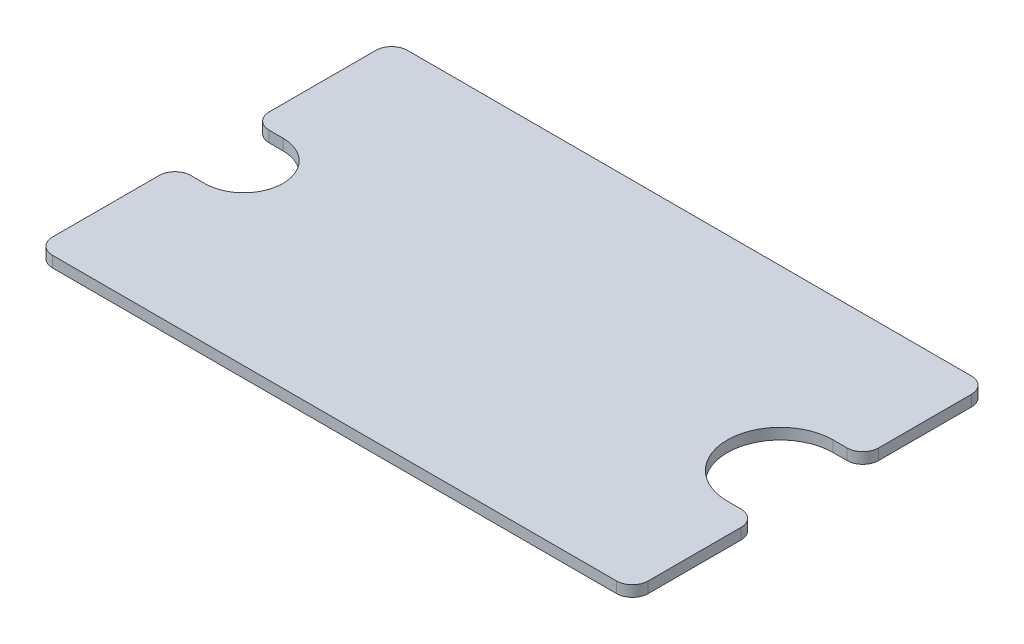
from build123d import *

# Parameters (mm, degrees)
SKETCH1_W           = 95
SKETCH1_H           = 60
BOSS_EXTRUDE1_DEPTH = 6
SKETCH6_R           = 3.5
SKETCH6_R_2         = 1.5
CUT_EXTRUDE3_DEPTH  = 113.521109131
CUT_EXTRUDE1_DEPTH  = 113.521109131
FILLET3_R           = 1.5
SKETCH7_W           = 8.5
SKETCH7_H           = 3
SKETCH7_H_2         = 7
CUT_EXTRUDE4_DEPTH  = 113.521109131
FILLET4_R           = 5
FILLET5_R           = 1.5
BOSS_EXTRUDE2_DEPTH = 1.6
SKETCH10_W          = 102.175429208
SKETCH10_H          = 24.243237214
CUT_EXTRUDE6_DEPTH  = 113.617760589


with BuildPart() as part:
    # Sketch1 → Boss-Extrude1 (new body)
    with BuildSketch(Plane(origin=(0, 0, 0), x_dir=(1, 0, 0), z_dir=(0, 1, 0))):
        with Locations((47.5, 30)):
            Rectangle(SKETCH1_W, SKETCH1_H)
    extrude(amount=BOSS_EXTRUDE1_DEPTH)

    # Sketch6 → Cut-Extrude3 (cut, through all)
    with BuildSketch(Plane.XZ):
        with Locations((86.5, -30)):
            Circle(SKETCH6_R)
        with Locations((8.5, -30)):
            Circle(SKETCH6_R_2)
    extrude(amount=-CUT_EXTRUDE3_DEPTH, mode=Mode.SUBTRACT)

    # Sketch2 → Cut-Extrude1 (cut, through all)
    with BuildSketch(Plane(origin=(0, 6, 0), x_dir=(-1, 0, 0), z_dir=(0, 1, 0))):
        with BuildLine():
            Line((-8.5, -36.5), (-5, -36.5))
            Line((-5, -36.5), (-5, -55))
            Line((-5, -55), (-90, -55))
            Line((-90, -55), (-90, -38.5))
            Line((-90, -38.5), (-86.5, -38.5))
            ThreePointArc((-86.5, -38.5), (-78, -30), (-86.5, -21.5))
            Line((-86.5, -21.5), (-90, -21.5))
            Line((-90, -21.5), (-90, -5))
            Line((-90, -5), (-5, -5))
            Line((-5, -5), (-5, -23.5))
            Line((-5, -23.5), (-8.5, -23.5))
            ThreePointArc((-8.5, -23.5), (-15, -30), (-8.5, -36.5))
        make_face()
    extrude(amount=-CUT_EXTRUDE1_DEPTH, mode=Mode.SUBTRACT)

    # Fillet3
    fillet3_edges = [part.edges().sort_by_distance(p)[0] for p in [
        (90, 3, -55),
    ]]
    fillet(fillet3_edges, radius=FILLET3_R)

    # Sketch7 → Cut-Extrude4 (cut, through all)
    with BuildSketch(Plane(origin=(0, 6, 0), x_dir=(-1, 0, 0), z_dir=(0, 1, 0))):
        with Locations((-4.25, -30)):
            Rectangle(SKETCH7_W, SKETCH7_H)
        with Locations((-90.75, -30)):
            Rectangle(SKETCH7_W, SKETCH7_H_2)
    extrude(amount=-CUT_EXTRUDE4_DEPTH, mode=Mode.SUBTRACT)

    # Fillet4
    fillet4_edges = [part.edges().sort_by_distance(p)[0] for p in [
        (95, 3, -33.5),
        (0, 3, 0),
        (0, 3, -28.5),
        (0, 3, -31.5),
        (0, 3, -60),
        (95, 3, -60),
        (95, 3, -26.5),
        (95, 3, 0),
    ]]
    fillet(fillet4_edges, radius=FILLET4_R)

    # Fillet5
    fillet5_edges = [part.edges().sort_by_distance(p)[0] for p in [
        (90, 3, -38.5),
        (90, 3, -5),
        (90, 3, -21.5),
        (5, 3, -5),
        (5, 3, -36.5),
        (5, 3, -23.5),
        (5, 3, -55),
    ]]
    fillet(fillet5_edges, radius=FILLET5_R)

    # Sketch9 → Boss-Extrude2 (add)
    with BuildSketch(Plane(origin=(0, 6, 0), x_dir=(1, 0, 0), z_dir=(0, 1, 0))):
        with BuildLine():
            Line((6.5, 4.2), (88.5, 4.2))
            ThreePointArc((88.5, 4.2), (90.126345597, 4.873654403), (90.8, 6.5))
            Line((90.8, 6.5), (90.8, 20))
            ThreePointArc((90.8, 20), (90.126345597, 21.626345597), (88.5, 22.3))
            Line((88.5, 22.3), (86.5, 22.3))
            ThreePointArc((86.5, 22.3), (78.8, 30), (86.5, 37.7))
            Line((86.5, 37.7), (88.5, 37.7))
            ThreePointArc((88.5, 37.7), (90.126345597, 38.373654403), (90.8, 40))
            Line((90.8, 40), (90.8, 53.5))
            ThreePointArc((90.8, 53.5), (90.126345597, 55.126345597), (88.5, 55.8))
            Line((88.5, 55.8), (6.5, 55.8))
            ThreePointArc((6.5, 55.8), (4.873654403, 55.126345597), (4.2, 53.5))
            Line((4.2, 53.5), (4.2, 38))
            ThreePointArc((4.2, 38), (4.873654403, 36.373654403), (6.5, 35.7))
            Line((6.5, 35.7), (8.5, 35.7))
            ThreePointArc((8.5, 35.7), (14.2, 30), (8.5, 24.3))
            Line((8.5, 24.3), (6.5, 24.3))
            ThreePointArc((6.5, 24.3), (4.873654403, 23.626345597), (4.2, 22))
            Line((4.2, 22), (4.2, 6.5))
            ThreePointArc((4.2, 6.5), (4.873654403, 4.873654403), (6.5, 4.2))
        make_face()
    extrude(amount=BOSS_EXTRUDE2_DEPTH)

    # Sketch10 → Cut-Extrude6 (cut, through all)
    with BuildSketch(Plane.XY):
        with Locations((51.087714604, -6.121618607)):
            Rectangle(SKETCH10_W, SKETCH10_H)
    extrude(amount=-CUT_EXTRUDE6_DEPTH, mode=Mode.SUBTRACT)


solid = part.part
